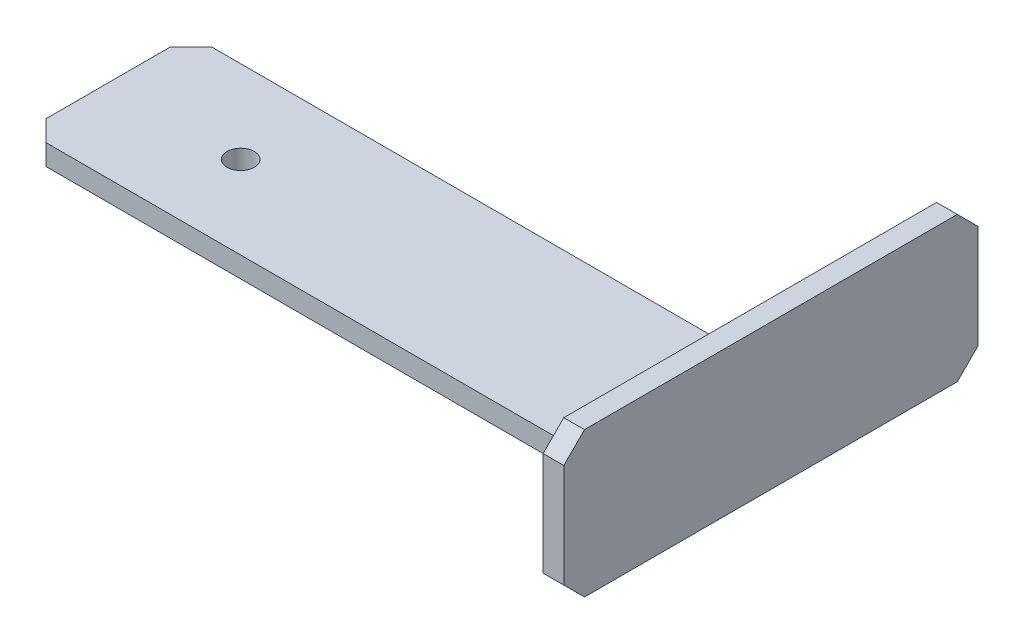
from build123d import *

# Parameters (mm, degrees)
SKETCH1_W           = 160
SKETCH1_H           = 40
SKETCH1_R           = 3.302
BOSS_EXTRUDE1_DEPTH = 5
SKETCH2_W           = 5
SKETCH2_H           = 100
BOSS_EXTRUDE2_DEPTH = 35
CHAMFER1_SIZE       = 5


with BuildPart() as part:
    # Sketch1 → Boss-Extrude1 (new body)
    with BuildSketch(Plane(origin=(0, 0, 0), x_dir=(1, 0, 0), z_dir=(0, 1, 0))):
        with Locations((80, 20)):
            Rectangle(SKETCH1_W, SKETCH1_H)
        with Locations(Location((32, 20, 0), (0, 0, 270))):
            Circle(SKETCH1_R, mode=Mode.SUBTRACT)
    extrude(amount=BOSS_EXTRUDE1_DEPTH)

    # Sketch2 → Boss-Extrude2 (add)
    with BuildSketch(Plane.XZ):
        with Locations((157.5, -20)):
            Rectangle(SKETCH2_W, SKETCH2_H)
    extrude(amount=-BOSS_EXTRUDE2_DEPTH)

    # Chamfer1
    chamfer1_edges = [part.edges().sort_by_distance(p)[0] for p in [
        (155, 2.5, -40),
        (157.5, 0, 30),
        (157.5, 0, -70),
        (155, 2.5, 0),
        (157.5, 35, 30),
        (157.5, 35, -70),
        (0, 2.5, -40),
        (0, 2.5, 0),
    ]]
    chamfer(chamfer1_edges, length=CHAMFER1_SIZE)


solid = part.part
